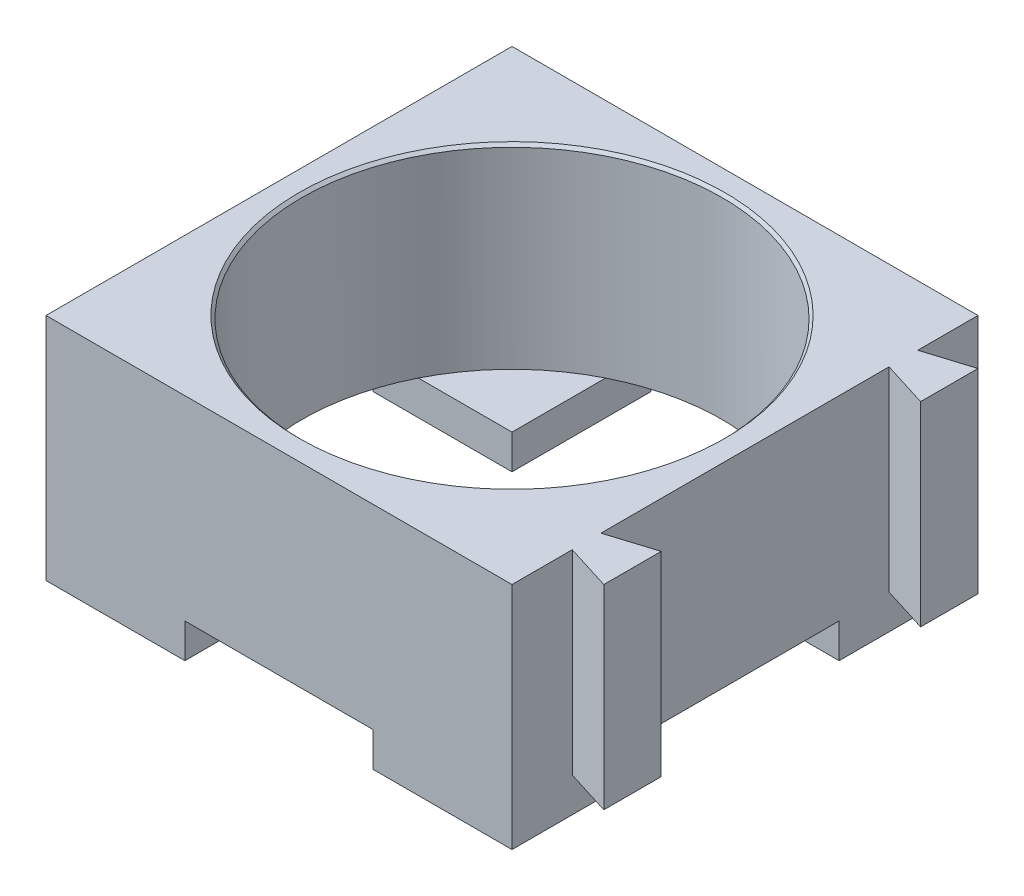
from build123d import *

# Parameters (mm, degrees)
SKETCH1_R              = 9.15
CELL_HOLDER_DEPTH      = 8.5
SKETCH2_W              = 6.05
SKETCH2_H              = 6.05
BOTTOM_BASE_BOSS_DEPTH = 1.5
CHAMFER1_SIZE          = 0.125


with BuildPart() as part:
    # Sketch1 → Cell Holder (new body)
    with BuildSketch(Plane(origin=(0, 0, 0), x_dir=(1, 0, 0), z_dir=(0, 1, 0))):
        Polygon((12.15, 8.15), (12.15, 5.65), (10.15, 6.275), (10.15, -6.275), (12.15, -5.65), (12.15, -8.15), (10.15, -7.525), (10.15, -10.15), (-10.15, -10.15), (-10.15, 10.15), (10.15, 10.15), (10.15, 7.525), align=None)
        with Locations(Location((0, 0, 0), (0, 0, 270))):
            Circle(SKETCH1_R, mode=Mode.SUBTRACT)
    extrude(amount=CELL_HOLDER_DEPTH)

    # Sketch2 → Bottom Base Boss (add)
    with BuildSketch(Plane.XZ):
        with Locations((-7.125, 7.125)):
            Rectangle(SKETCH2_W, SKETCH2_H)
        with Locations((-7.125, -7.125)):
            Rectangle(SKETCH2_W, SKETCH2_H)
        with Locations((7.125, 7.125)):
            Rectangle(SKETCH2_W, SKETCH2_H)
        with Locations((7.125, -7.125)):
            Rectangle(SKETCH2_W, SKETCH2_H)
    extrude(amount=BOTTOM_BASE_BOSS_DEPTH)

    # Chamfer1
    chamfer1_edges = [part.edges().sort_by_distance(p)[0] for p in [
        (0, 8.5, -9.15),
    ]]
    chamfer(chamfer1_edges, length=CHAMFER1_SIZE)


solid = part.part
